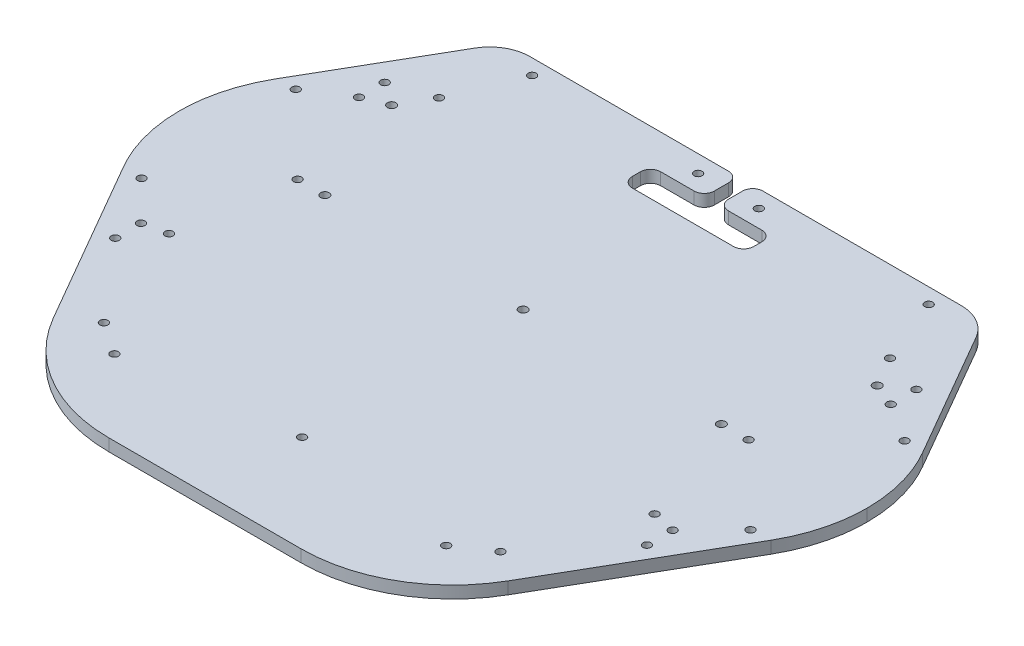
from build123d import *

# Parameters (mm, degrees)
BOSS_EXTRUDE1_DEPTH    = 6
CUT_EXTRUDE1_DEPTH     = 232.669185723
M3_5_CLEARANCE_HOLE1_D = 4.199808185
M3_5_CLEARANCE_HOLE2_D = 3.949622561
FILLET1_R              = 5.024738629
FILLET2_R              = 19.924521471
FILLET3_R              = 74.958538247


with BuildPart() as part:
    # Sketch1 → Boss-Extrude1 (new body)
    with BuildSketch(Plane(origin=(0, 6, 0), x_dir=(1, 0, 0), z_dir=(0, 1, 0))):
        with BuildLine():
            Line((118.094019457, 109.999994984), (-118.094002078, 109.999994984))
            Line((-118.094002078, 109.999994984), (-159.951896595, 37.499994984))
            add(Edge.make_bspline(
                [(-159.951896595, 37.499994984), (-162.089834317, 33.796773054), (-165.842582605, 25.786056062), (-169.244504237, 13.08991169), (-169.999887381, 4.276053128), (-169.999989967, 0)],
                knots=[5.759586536, 5.759586536, 5.759586536, 5.759586536, 5.930628798, 6.11214304, 6.283185303, 6.283185303, 6.283185303, 6.283185303], degree=3))
            add(Edge.make_bspline(
                [(-169.999989967, 0), (-169.999887381, -4.276053128), (-169.244504237, -13.089911689), (-165.842582605, -25.786056062), (-162.089834317, -33.796773054), (-159.951896595, -37.499994984)],
                knots=[4e-09, 4e-09, 4e-09, 4e-09, 0.171042267, 0.352556509, 0.523598771, 0.523598771, 0.523598771, 0.523598771], degree=3))
            Line((-159.951896595, -37.499994984), (-90.801270189, -157.27241336))
            Line((-90.801270189, -157.27241336), (90.801270189, -157.27241336))
            Line((90.801270189, -157.27241336), (159.951905284, -37.5))
            add(Edge.make_bspline(
                [(159.951905284, -37.5), (162.089843006, -33.79677807), (165.842591294, -25.786061079), (169.244512926, -13.089916706), (169.99989607, -4.276058145), (169.999998656, -5.016e-06)],
                knots=[2.617993882, 2.617993882, 2.617993882, 2.617993882, 2.789036145, 2.970550387, 3.141592649, 3.141592649, 3.141592649, 3.141592649], degree=3))
            add(Edge.make_bspline(
                [(169.999998656, -5.016e-06), (169.99989607, 4.276048112), (169.244512926, 13.089906673), (165.842591294, 25.786051046), (162.089843006, 33.796768038), (159.951905284, 37.499989968)],
                knots=[3.141592658, 3.141592658, 3.141592658, 3.141592658, 3.31263492, 3.494149162, 3.665191425, 3.665191425, 3.665191425, 3.665191425], degree=3))
            Line((159.951905284, 37.499989968), (118.094019457, 109.999994984))
        make_face()
    extrude(amount=-BOSS_EXTRUDE1_DEPTH)

    # Sketch2 → Cut-Extrude1 (cut, through all)
    with BuildSketch(Plane.XZ):
        Polygon((3.5, -110), (3.5, -93), (30, -93), (30, -79), (-30, -79), (-30, -93), (-3.5, -93), (-3.5, -110), align=None)
    extrude(amount=-CUT_EXTRUDE1_DEPTH, mode=Mode.SUBTRACT)

    # M3.5 Clearance Hole1 (through all)
    with Locations(Plane(origin=(0, 0, 0), x_dir=(-1, 0, 0), z_dir=(0, -1, 0))):
        with Locations((0, -0.001547229), (-97.9932, 0.001547229), (97.9932, 0.001547229), (120, 55.001547229), (-120, 55.001547229)):
            Hole(M3_5_CLEARANCE_HOLE1_D / 2)

    # M3.5 Clearance Hole2 (through all)
    with Locations(Plane(origin=(0, 0, 0), x_dir=(-1, 0, 0), z_dir=(0, -1, 0))):
        with Locations((98, 102.43824134), (0, -109.21995866), (98, -109.21995866), (-98, -109.21995866), (111.4552, 69.84995866), (111.4552, -4.134e-05), (-111.4552, 69.84995866), (-111.4552, -4.134e-05), (-120, -55.00004134), (120, -55.00004134), (131.4, 50.30004134), (-131.4, 50.30004134), (131.4, -70.19995866), (-131.4, -70.19995866), (131.4, 63.00004134), (-131.4, 63.00004134), (131.4, -57.49995866), (-131.4, -57.49995866), (15, 101.50004134), (-98, 102.43824134), (-15, 101.50004134), (150.47, 38.10004134), (150.47, -38.09995866), (-150.47, 38.10004134), (-150.47, -38.09995866), (-82, -119.99995866), (82, -119.99995866)):
            Hole(M3_5_CLEARANCE_HOLE2_D / 2)

    # Fillet1
    fillet1_edges = [part.edges().sort_by_distance(p)[0] for p in [
        (-3.5, 3, -109.999994984),
        (-30, 3, -79),
        (30, 3, -79),
        (3.5, 3, -109.999994984),
        (-30, 3, -93),
        (-3.5, 3, -93),
        (30, 3, -93),
        (3.5, 3, -93),
    ]]
    fillet(fillet1_edges, radius=FILLET1_R)

    # Fillet2
    fillet2_edges = [part.edges().sort_by_distance(p)[0] for p in [
        (118.094019457, 3, -109.999994984),
        (-118.094002078, 3, -109.999994984),
    ]]
    fillet(fillet2_edges, radius=FILLET2_R)

    # Fillet3
    fillet3_edges = [part.edges().sort_by_distance(p)[0] for p in [
        (90.801270189, 3, 157.27241336),
        (-90.801270189, 3, 157.27241336),
    ]]
    fillet(fillet3_edges, radius=FILLET3_R)


solid = part.part
